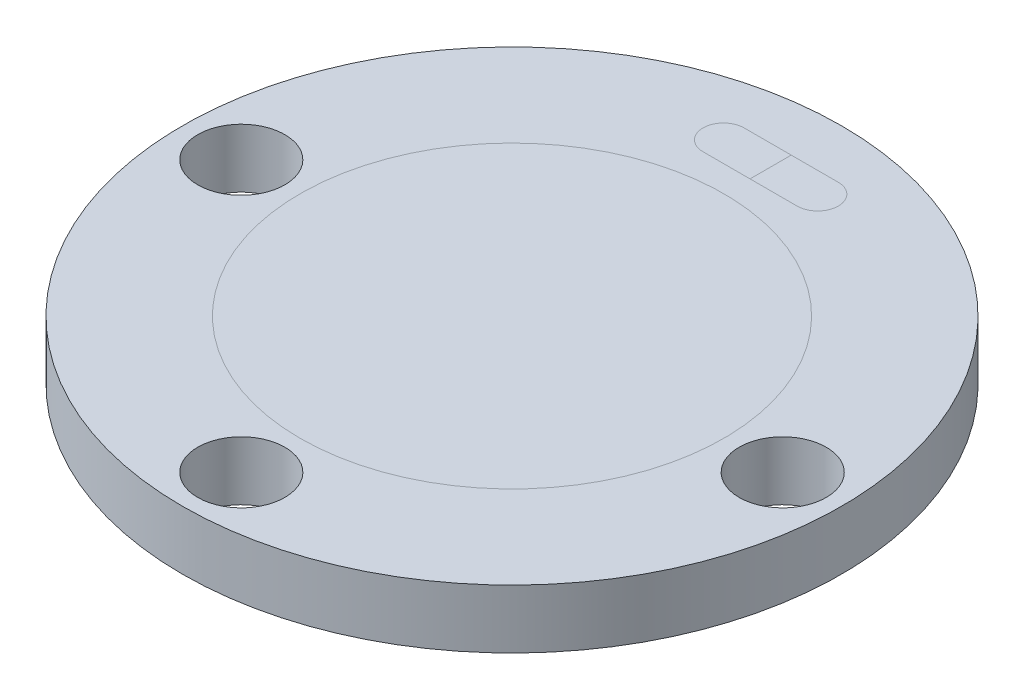
from build123d import *

# Parameters (mm, degrees)
SKETCH_1_R          = 28
EXTRUDE_1_DEPTH     = 3
SKETCH_7_R          = 3.7
CUT_EXTRUDE_1_DEPTH = 10
SKETCH_8_R          = 3.7
CUT_EXTRUDE_2_DEPTH = 10
SKETCH_9_R          = 3.7
CUT_EXTRUDE_3_DEPTH = 10
EXTRUDE_START       = -2
SKETCH_1_3_R        = 28
EXTRUDE_3_DEPTH     = 2
SKETCH_9_2_R        = 3.7
CUT_EXTRUDE_4_DEPTH = 5
SKETCH_8_2_R        = 3.7
CUT_EXTRUDE_5_DEPTH = 5
SKETCH_7_2_R        = 3.7
CUT_EXTRUDE_6_DEPTH = 5


with BuildPart() as part:
    # 草图1 → 凸台-拉伸1 (new body)
    with BuildSketch(Plane(origin=(0, 0, 0), x_dir=(1, 0, 0), z_dir=(0, 1, 0))):
        Circle(SKETCH_1_R)
    extrude(amount=EXTRUDE_1_DEPTH)

    # 草图7 → 切除-拉伸1 (cut)
    with BuildSketch(Plane(origin=(0, 3, 0), x_dir=(1, 0, 0), z_dir=(0, 1, 0))):
        with Locations((23, 0)):
            Circle(SKETCH_7_R)
    extrude(amount=-CUT_EXTRUDE_1_DEPTH, mode=Mode.SUBTRACT)

    # 草图8 → 切除-拉伸2 (cut)
    with BuildSketch(Plane(origin=(0, 3, 0), x_dir=(1, 0, 0), z_dir=(0, 1, 0))):
        with Locations((-23, 0)):
            Circle(SKETCH_8_R)
    extrude(amount=-CUT_EXTRUDE_2_DEPTH, mode=Mode.SUBTRACT)

    # 草图9 → 切除-拉伸3 (cut)
    with BuildSketch(Plane(origin=(0, 3, 0), x_dir=(1, 0, 0), z_dir=(0, 1, 0))):
        with Locations((0, -23)):
            Circle(SKETCH_9_R)
    extrude(amount=-CUT_EXTRUDE_3_DEPTH, mode=Mode.SUBTRACT)

    # 草图1<3> → 凸台-拉伸3 (add)
    with BuildSketch(Plane(origin=(0, 0, 0), x_dir=(1, 0, 0), z_dir=(0, 1, 0)).offset(EXTRUDE_START)):
        Circle(SKETCH_1_3_R)
    extrude(amount=EXTRUDE_3_DEPTH)

    # 草图9<2> → 切除-拉伸4 (cut)
    with BuildSketch(Plane(origin=(0, 3, 0), x_dir=(1, 0, 0), z_dir=(0, 1, 0))):
        with Locations((0, -23)):
            Circle(SKETCH_9_2_R)
    extrude(amount=-CUT_EXTRUDE_4_DEPTH, mode=Mode.SUBTRACT)

    # 草图8<2> → 切除-拉伸5 (cut)
    with BuildSketch(Plane(origin=(0, 3, 0), x_dir=(1, 0, 0), z_dir=(0, 1, 0))):
        with Locations((-23, 0)):
            Circle(SKETCH_8_2_R)
    extrude(amount=-CUT_EXTRUDE_5_DEPTH, mode=Mode.SUBTRACT)

    # 草图7<2> → 切除-拉伸6 (cut)
    with BuildSketch(Plane(origin=(0, 3, 0), x_dir=(1, 0, 0), z_dir=(0, 1, 0))):
        with Locations((23, 0)):
            Circle(SKETCH_7_2_R)
    extrude(amount=-CUT_EXTRUDE_6_DEPTH, mode=Mode.SUBTRACT)


solid = part.part
